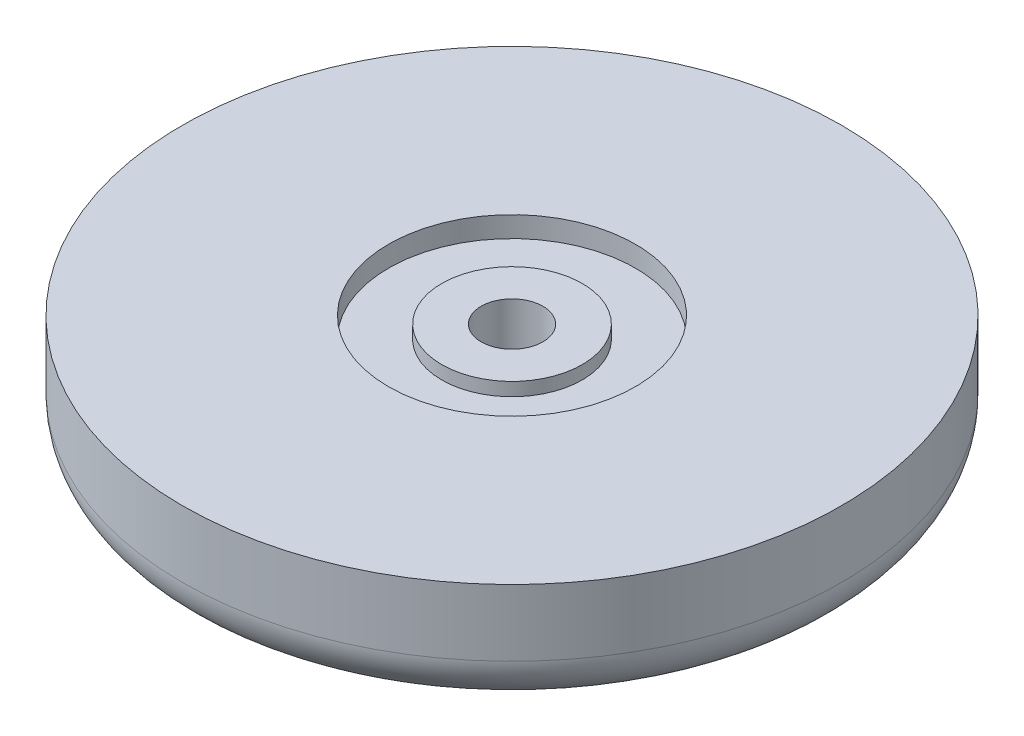
from build123d import *

# Parameters (mm, degrees)
SKETCH1_R           = 44.069
BOSS_EXTRUDE1_DEPTH = 15.24
SKETCH3_R           = 16.51
CUT_EXTRUDE1_DEPTH  = 2.771775
SKETCH4_R           = 4.1275
CUT_EXTRUDE2_DEPTH  = 64.557927567
BOSS_EXTRUDE2_START = 1.778
SKETCH5_R           = 9.398
SKETCH5_R_2         = 4.1275
BOSS_EXTRUDE2_DEPTH = 1.778
FILLET1_R           = 6.35
SKETCH6_R           = 31.75
SKETCH6_R_2         = 24.765
CUT_EXTRUDE3_DEPTH  = 1.27


with BuildPart() as part:
    # Sketch1 → Boss-Extrude1 (new body)
    with BuildSketch(Plane(origin=(0, 0, 0), x_dir=(1, 0, 0), z_dir=(0, 1, 0))):
        with Locations(Location((0, 0, 0), (0, 0, 90))):
            Circle(SKETCH1_R)
    extrude(amount=BOSS_EXTRUDE1_DEPTH)

    # Sketch3 → Cut-Extrude1 (cut)
    with BuildSketch(Plane(origin=(0, 15.24, 0), x_dir=(1, 0, 0), z_dir=(0, 1, 0))):
        with Locations(Location((0, 0, 0), (0, 0, 270))):
            Circle(SKETCH3_R)
    extrude(amount=-CUT_EXTRUDE1_DEPTH, mode=Mode.SUBTRACT)

    # Sketch4 → Cut-Extrude2 (cut, through all)
    with BuildSketch(Plane(origin=(0, 12.468225, 0), x_dir=(1, 0, 0), z_dir=(0, 1, 0))):
        with Locations(Location((0, 0, 0), (0, 0, 270))):
            Circle(SKETCH4_R)
    extrude(amount=-CUT_EXTRUDE2_DEPTH, mode=Mode.SUBTRACT)

    # Sketch5 → Boss-Extrude2 (add)
    with BuildSketch(Plane(origin=(0, 12.468225, 0), x_dir=(1, 0, 0), z_dir=(0, 1, 0)).offset(BOSS_EXTRUDE2_START)):
        with Locations(Location((0, 0, 0), (0, 0, 270))):
            Circle(SKETCH5_R)
        with Locations(Location((0, 0, 0), (0, 0, 270))):
            Circle(SKETCH5_R_2, mode=Mode.SUBTRACT)
    extrude(amount=-BOSS_EXTRUDE2_DEPTH)

    # Fillet1
    fillet1_edges = [part.edges().sort_by_distance(p)[0] for p in [
        (0, 0, 44.069),
    ]]
    fillet(fillet1_edges, radius=FILLET1_R)

    # Sketch6 → Cut-Extrude3 (cut)
    with BuildSketch(Plane.XZ):
        with Locations(Location((0, 0, 0), (0, 0, 270))):
            Circle(SKETCH6_R)
        with Locations(Location((0, 0, 0), (0, 0, 270))):
            Circle(SKETCH6_R_2, mode=Mode.SUBTRACT)
    extrude(amount=-CUT_EXTRUDE3_DEPTH, mode=Mode.SUBTRACT)


solid = part.part
